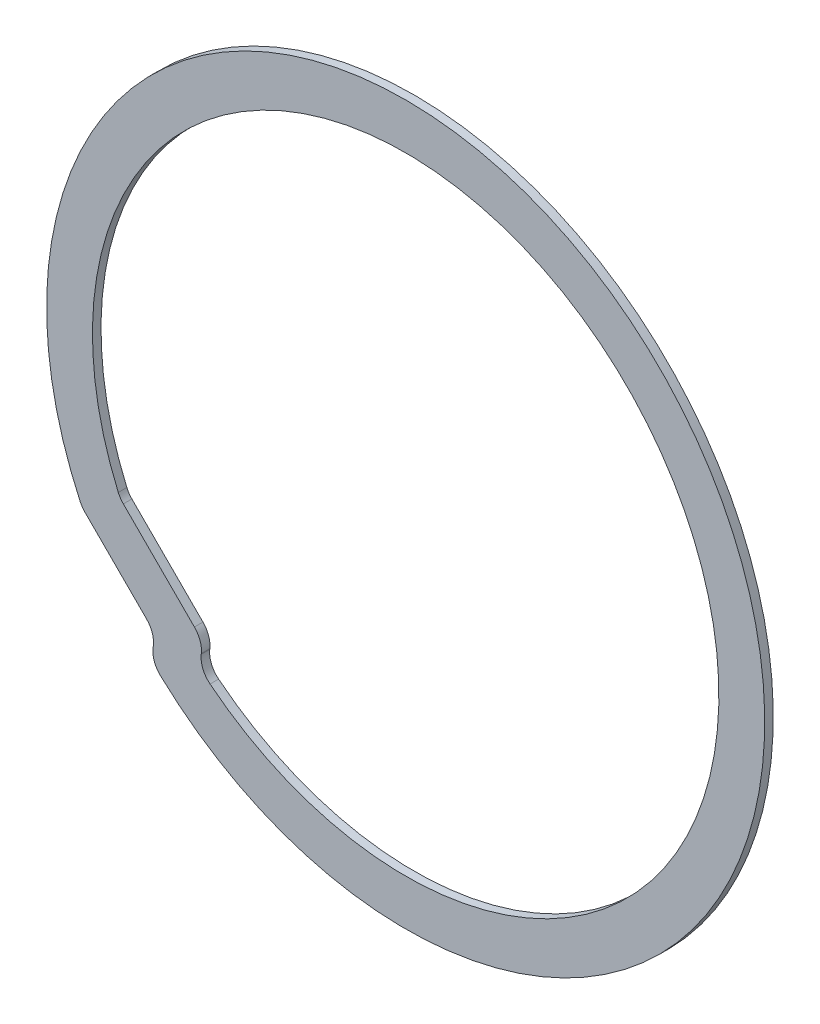
from build123d import *

# Parameters (mm, degrees)
BOSS_EXTRUDE1_DEPTH = 1.5875
CUT_EXTRUDE1_DEPTH  = 3.175
FILLET1_R           = 8.89


with BuildPart() as part:
    # Sketch1 → Boss-Extrude1 (new, symmetric)
    with BuildSketch(Plane.XY):
        with BuildLine():
            Line((-120.187952283, -34.272453), (-93.24718392, -61.213221363))
            Line((-93.24718392, -61.213221363), (-94.292689271, -70.797689271))
            ThreePointArc((-94.292689271, -70.797689271), (-77.124658044, -85.289234251), (-57.767453, -96.692952283))
            ThreePointArc((-57.767453, -96.692952283), (94.292689271, 117.787689271), (-120.187952283, -34.272453))
        make_face()
    extrude(amount=BOSS_EXTRUDE1_DEPTH, both=True)

    # Sketch2 → Cut-Extrude1 (cut)
    with BuildSketch(Plane.XY.offset(1.5875)):
        with BuildLine():
            Line((-75.444853145, -54.948465733), (-76.452621523, -64.186987239))
            ThreePointArc((-76.452621523, -64.186987239), (93.390560198, 92.85880533), (-106.033048043, -24.360270835))
            Line((-106.033048043, -24.360270835), (-75.444853145, -54.948465733))
        make_face()
    extrude(amount=-CUT_EXTRUDE1_DEPTH, mode=Mode.SUBTRACT)

    # Fillet1
    fillet1_edges = [part.edges().sort_by_distance(p)[0] for p in [
        (-75.444853145, -54.948465733, 0),
        (-106.033048043, -24.360270835, 0),
        (-76.452621523, -64.186987239, 0),
        (-93.24718392, -61.213221363, -0.79375),
        (-120.187952283, -34.272453, -0.79375),
        (-94.292689271, -70.797689271, -0.79375),
    ]]
    fillet(fillet1_edges, radius=FILLET1_R)


solid = part.part
